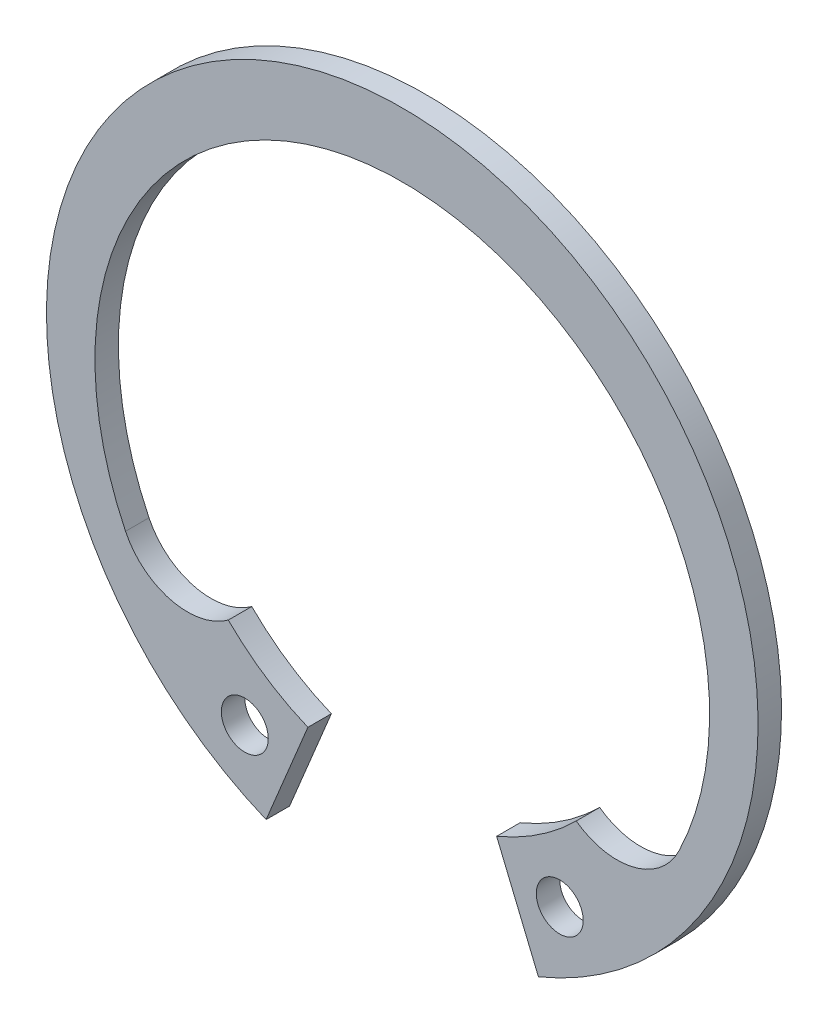
from build123d import *

# Parameters (mm, degrees)
SKETCH1_R  = 1.5
BODY_DEPTH = 1.5


with BuildPart() as part:
    # Sketch1 → Body (new body)
    with BuildSketch(Plane.XY):
        with BuildLine():
            Line((-6.034917728, -14.569580228), (-8.706048086, -21.018259365))
            ThreePointArc((-8.706048086, -21.018259365), (0, 22.75), (8.706048086, -21.018259365))
            Line((8.706048086, -21.018259365), (6.034917728, -14.569580228))
            ThreePointArc((6.034917728, -14.569580228), (8.745631508, -13.122759981), (11.124330326, -11.177753567))
            ThreePointArc((11.124330326, -11.177753567), (14.791497368, -11.903959421), (17.693611897, -9.547432248))
            ThreePointArc((17.693611897, -9.547432248), (0, 18.65), (-17.693611897, -9.547432248))
            ThreePointArc((-17.693611897, -9.547432248), (-14.791497368, -11.903959421), (-11.124330326, -11.177753567))
            ThreePointArc((-11.124330326, -11.177753567), (-8.745631508, -13.122759981), (-6.034917728, -14.569580228))
        make_face()
        with Locations(Location((10.067656556, -16.46609521, 0), (0, 0, 180))):
            Circle(SKETCH1_R, mode=Mode.SUBTRACT)
        with Locations((-10.067656556, -16.46609521)):
            Circle(SKETCH1_R, mode=Mode.SUBTRACT)
    extrude(amount=-BODY_DEPTH)


solid = part.part
